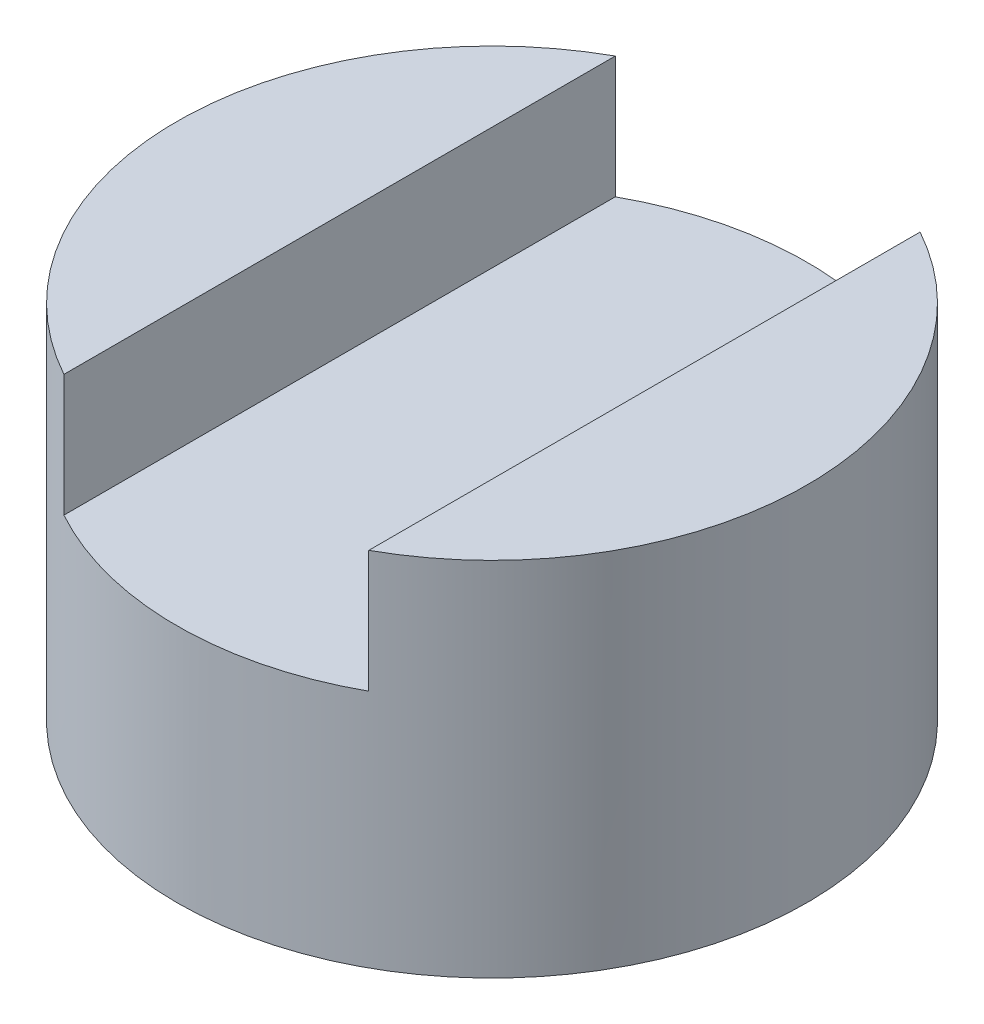
from build123d import *

# Parameters (mm, degrees)
SKETCH_1_R          = 15.5
EXTRUDE_1_DEPTH     = 17.8
CUT_EXTRUDE_START   = -6
CUT_EXTRUDE_1_DEPTH = 6


with BuildPart() as part:
    # 草图1 → 凸台-拉伸1 (new body)
    with BuildSketch(Plane(origin=(0, 0, 0), x_dir=(1, 0, 0), z_dir=(0, 1, 0))):
        with Locations(Location((0, 0, 0), (0, 0, 270))):
            Circle(SKETCH_1_R)
    extrude(amount=EXTRUDE_1_DEPTH)

    # 草图2 → 切除-拉伸1 (cut)
    with BuildSketch(Plane(origin=(0, 17.8, 0), x_dir=(1, 0, 0), z_dir=(0, 1, 0)).offset(CUT_EXTRUDE_START)):
        with BuildLine():
            Line((-7.5, 13.564659966), (-7.5, -13.564659966))
            ThreePointArc((-7.5, -13.564659966), (0, -15.5), (7.5, -13.564659966))
            Line((7.5, -13.564659966), (7.5, 13.564659966))
            ThreePointArc((7.5, 13.564659966), (0, 15.5), (-7.5, 13.564659966))
        make_face()
    extrude(amount=CUT_EXTRUDE_1_DEPTH, mode=Mode.SUBTRACT)


solid = part.part
